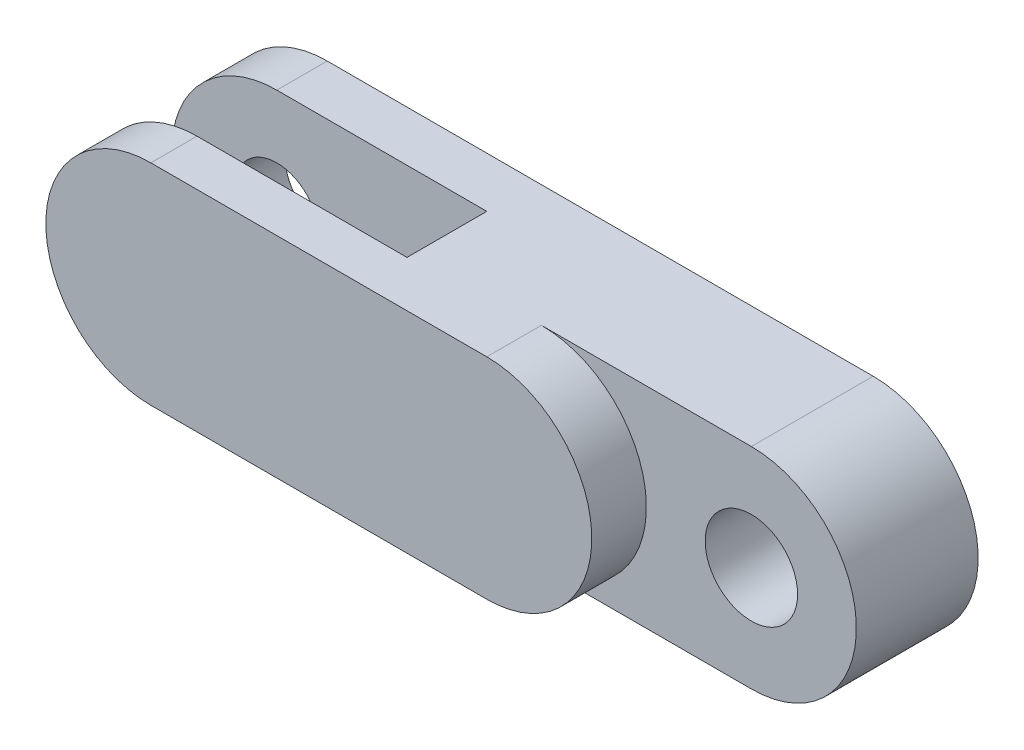
from build123d import *

# Parameters (mm, degrees)
BOSS_EXTRUDE1_DEPTH     = 2.1
CUT_EXTRUDE1_DEPTH      = 1.3
SKETCH3_R               = 1.1
CUT_EXTRUDE2_DEPTH      = 10.780593029
CUT_EXTRUDE3_DEPTH      = 10.573922916
CUT_EXTRUDE3_DEPTH_BACK = 10.573922916
SKETCH4_W               = 7.5
SKETCH4_H               = 1.9
SKETCH5_R               = 1
CUT_EXTRUDE4_DEPTH      = 10.810708435


with BuildPart() as part:
    # Sketch1 → Boss-Extrude1 (new, symmetric)
    with BuildSketch(Plane.XY):
        with BuildLine():
            Line((6.5, -2.5), (-6.5, -2.5))
            ThreePointArc((-6.5, -2.5), (-9, 0), (-6.5, 2.5))
            Line((-6.5, 2.5), (6.5, 2.5))
            ThreePointArc((6.5, 2.5), (9, 0), (6.5, -2.5))
        make_face()
    extrude(amount=BOSS_EXTRUDE1_DEPTH, both=True)

    # Sketch2 → Cut-Extrude1 (cut)
    with BuildSketch(Plane.XY.offset(2.1)):
        with BuildLine():
            Line((6.5, 2.5), (1.5, 2.5))
            ThreePointArc((1.5, 2.5), (4, 0), (1.5, -2.5))
            Line((1.5, -2.5), (6.5, -2.5))
            ThreePointArc((6.5, -2.5), (9, 0), (6.5, 2.5))
        make_face()
    extrude(amount=-CUT_EXTRUDE1_DEPTH, mode=Mode.SUBTRACT)

    # Sketch3 → Cut-Extrude2 (cut, through all)
    with BuildSketch(Plane.XY.offset(0.8)):
        with Locations((6.5, 0)):
            Circle(SKETCH3_R)
    extrude(amount=-CUT_EXTRUDE2_DEPTH, mode=Mode.SUBTRACT)

    # Sketch4 → Cut-Extrude3 (cut, two sides: drawn at the far end of the back side and taken through both)
    with BuildSketch(Plane(origin=(0, 0, 0), x_dir=(1, 0, 0), z_dir=(0, 1, 0)).offset(-CUT_EXTRUDE3_DEPTH_BACK)):
        with Locations((-5.25, -0.05)):
            Rectangle(SKETCH4_W, SKETCH4_H)
    extrude(amount=CUT_EXTRUDE3_DEPTH + CUT_EXTRUDE3_DEPTH_BACK, mode=Mode.SUBTRACT)

    # Sketch5 → Cut-Extrude4 (cut, through all)
    with BuildSketch(Plane.XY.offset(-0.9)):
        with Locations((-6.5, 0)):
            Circle(SKETCH5_R)
    extrude(amount=-CUT_EXTRUDE4_DEPTH, mode=Mode.SUBTRACT)


solid = part.part
